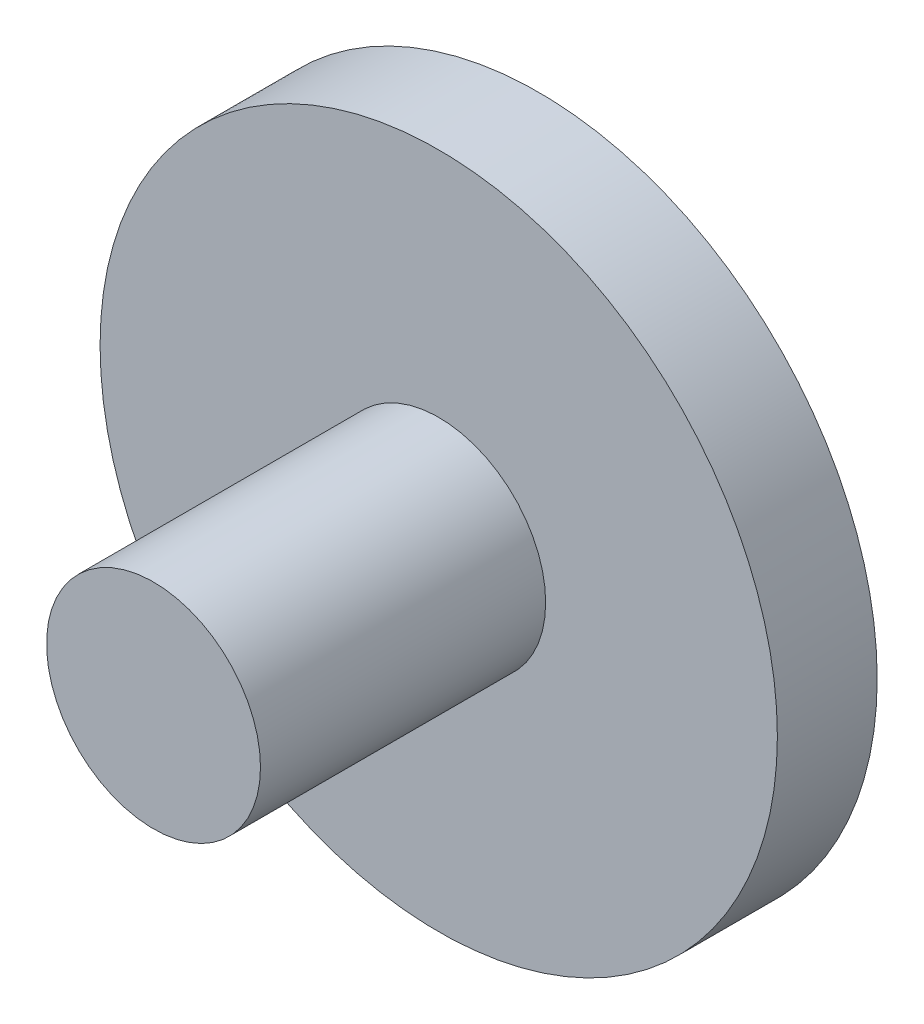
from build123d import *

# Parameters (mm, degrees)
SKETCH_1_R          = 4.75
EXTRUDE_1_DEPTH     = 1.4
SKETCH_2_R          = 1.5
EXTRUDE_2_DEPTH     = 4
SKETCH_3_W          = 0.760348124
SKETCH_3_H          = 2.271623197
SKETCH_3_W_2        = 1.135811598
SKETCH_3_H_2        = 0.62458345
CUT_EXTRUDE_1_DEPTH = 1


with BuildPart() as part:
    # 草图1 → 凸台-拉伸1 (new body)
    with BuildSketch(Plane.XY):
        Circle(SKETCH_1_R)
    extrude(amount=EXTRUDE_1_DEPTH)

    # 草图2 → 凸台-拉伸2 (add)
    with BuildSketch(Plane.XY.offset(1.4)):
        Circle(SKETCH_2_R)
    extrude(amount=EXTRUDE_2_DEPTH)

    # 草图3 → 切除-拉伸1 (cut)
    with BuildSketch(Plane(origin=(0, 0, 0), x_dir=(-1, 0, 0), z_dir=(0, 0, -1))):
        with Locations((0, 1.448103324)):
            Rectangle(SKETCH_3_W, SKETCH_3_H)
        with Locations((-0.948079861, 0)):
            Rectangle(SKETCH_3_W_2, SKETCH_3_H_2)
        with Locations((0.948079861, 0)):
            Rectangle(SKETCH_3_W_2, SKETCH_3_H_2)
        with Locations((0, -1.448103324)):
            Rectangle(SKETCH_3_W, SKETCH_3_H)
        Rectangle(SKETCH_3_W, SKETCH_3_H_2)
    extrude(amount=-CUT_EXTRUDE_1_DEPTH, mode=Mode.SUBTRACT)


solid = part.part
